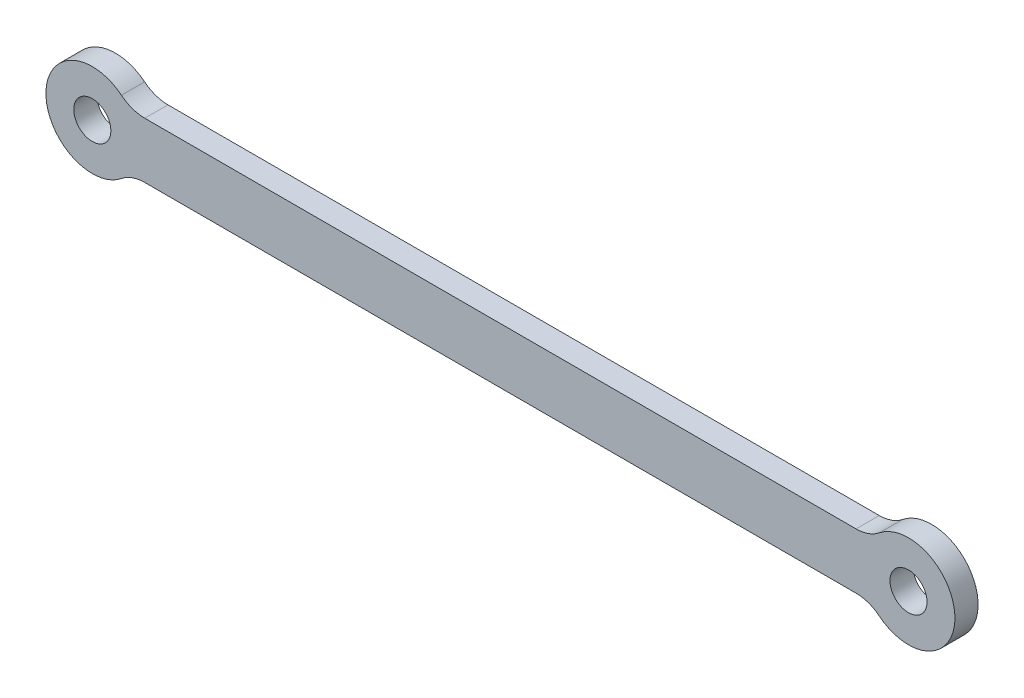
from build123d import *

# Parameters (mm, degrees)
SKETCH_1_R          = 2.1
EXTRUDE_1_DEPTH     = 5
SKETCH_2_R          = 10
EXTRUDE_2_DEPTH     = 5
SKETCH_3_R          = 4
CUT_EXTRUDE_1_DEPTH = 5
FILLET_1_R          = 8


with BuildPart() as part:
    # 草图1 → 凸台-拉伸1 (new body)
    with BuildSketch(Plane.XY):
        with BuildLine():
            Line((-88, 6), (88, 6))
            ThreePointArc((88, 6), (94, 0), (88, -6))
            Line((88, -6), (-88, -6))
            ThreePointArc((-88, -6), (-94, 0), (-88, 6))
        make_face()
        with Locations((88, 0)):
            Circle(SKETCH_1_R, mode=Mode.SUBTRACT)
        with Locations((-88, 0)):
            Circle(SKETCH_1_R, mode=Mode.SUBTRACT)
    extrude(amount=EXTRUDE_1_DEPTH)

    # 草图2 → 凸台-拉伸2 (add)
    with BuildSketch(Plane.XY.offset(5)):
        with Locations((-88, 0)):
            Circle(SKETCH_2_R)
        with Locations((88, 0)):
            Circle(SKETCH_2_R)
    extrude(amount=-EXTRUDE_2_DEPTH)

    # 草图3 → 切除-拉伸1 (cut)
    with BuildSketch(Plane.XY.offset(5)):
        with Locations((-88, 0)):
            Circle(SKETCH_3_R)
        with Locations((88, 0)):
            Circle(SKETCH_3_R)
    extrude(amount=-CUT_EXTRUDE_1_DEPTH, mode=Mode.SUBTRACT)

    # 圆角1
    fillet_1_edges = [part.edges().sort_by_distance(p)[0] for p in [
        (-80, 6, 2.5),
        (-80, -6, 2.5),
        (80, 6, 2.5),
        (80, -6, 2.5),
    ]]
    fillet(fillet_1_edges, radius=FILLET_1_R)


solid = part.part
